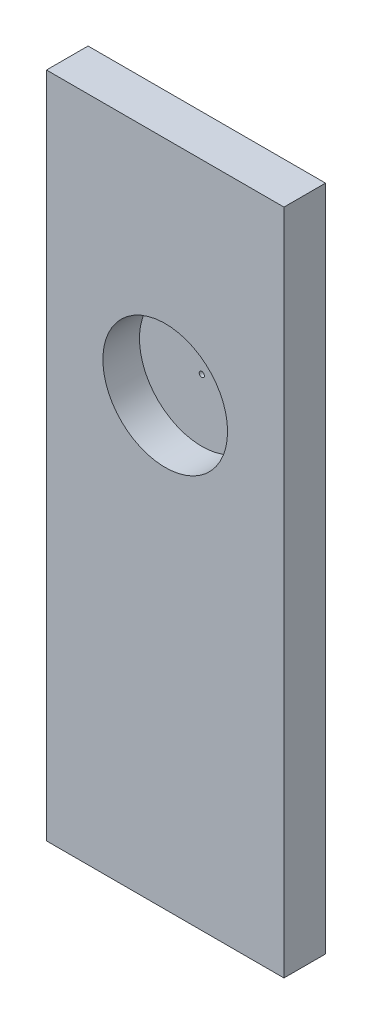
from build123d import *

# Parameters (mm, degrees)
SKETCH1_W                       = 36.27882
SKETCH1_H                       = 102.003225
EXTRUDE1_DEPTH                  = 6.35
SKETCH2_R                       = 9.525
EXTRUDE2_DEPTH                  = 5.588
SKETCH3_R                       = 0.396875
EXTRUDE3_DEPTH                  = 55.419007863
F_3_48_TAPPED_HOLE1_D           = 1.9939
F_3_48_TAPPED_HOLE1_DEPTH       = 9.144
F_3_48_TAPPED_HOLE1_CBORE_D     = 2.5146
F_3_48_TAPPED_HOLE1_CBORE_DEPTH = 7.62
F_3_48_TAPPED_HOLE1_TIP         = 0.599027994


with BuildPart() as part:
    # Sketch1 → Extrude1 (new body)
    with BuildSketch(Plane.XY):
        Rectangle(SKETCH1_W, SKETCH1_H)
    extrude(amount=EXTRUDE1_DEPTH)

    # Sketch2 → Extrude2 (cut)
    with BuildSketch(Plane.XY.offset(6.35)):
        with Locations((0, 17.0005375)):
            Circle(SKETCH2_R)
    extrude(amount=-EXTRUDE2_DEPTH, mode=Mode.SUBTRACT)

    # Sketch3 → Extrude3 (cut, through all)
    with BuildSketch(Plane.XY.offset(0.762)):
        with Locations((0, 17.0005375)):
            Circle(SKETCH3_R)
    extrude(amount=-EXTRUDE3_DEPTH, mode=Mode.SUBTRACT)

    # #3-48 Tapped Hole1
    with Locations(Plane(origin=(-14.071004552, -51.0016125, -59.648711207), x_dir=(0, 0, -1), z_dir=(0, -1, 0))):
        with Locations((-62.823711207, 25.860414552), (-62.823711207, 0.892214552)):
            CounterBoreHole(F_3_48_TAPPED_HOLE1_D / 2, F_3_48_TAPPED_HOLE1_CBORE_D / 2, F_3_48_TAPPED_HOLE1_CBORE_DEPTH, depth=F_3_48_TAPPED_HOLE1_DEPTH)
            with Locations((0, 0, -(F_3_48_TAPPED_HOLE1_DEPTH + F_3_48_TAPPED_HOLE1_TIP / 2))):  # 118° drill point
                Cone(0, F_3_48_TAPPED_HOLE1_D / 2, F_3_48_TAPPED_HOLE1_TIP, mode=Mode.SUBTRACT)


solid = part.part
